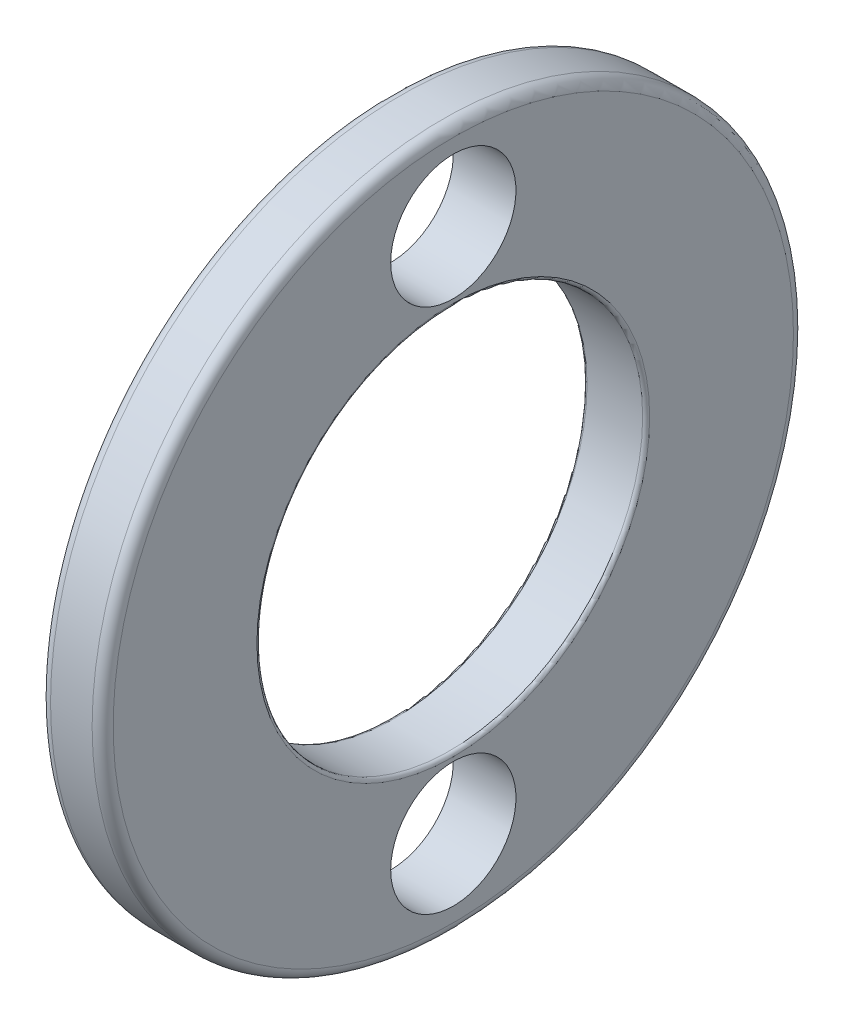
from build123d import *

# Parameters (mm, degrees)
CROQUIS2_R     = 3.572
EXTRUIR1_DEPTH = 12.358
CROQUIS3_R     = 3.572
EXTRUIR2_DEPTH = 12.358


with BuildPart() as part:
    # Croquis1 → Revolución1 (revolve)
    with BuildSketch(Plane.XY, mode=Mode.PRIVATE) as revoluci_n1_sk:
        with BuildLine():
            Line((5.214, 19.4), (5.214, 11.2))
            ThreePointArc((5.214, 11.2), (5.272578644, 11.058578644), (5.414, 11))
            Line((5.414, 11), (8.586, 11))
            ThreePointArc((8.586, 11), (8.727421356, 11.058578644), (8.786, 11.2))
            Line((8.786, 11.2), (8.786, 19.4))
            ThreePointArc((8.786, 19.4), (8.610264069, 19.824264069), (8.186, 20))
            Line((8.186, 20), (5.814, 20))
            ThreePointArc((5.814, 20), (5.389735931, 19.824264069), (5.214, 19.4))
        make_face()
    revolve(revoluci_n1_sk.sketch.rotate(Axis((50, 0, 0), (-1, 0, 0)), 90), axis=Axis((50, 0, 0), (-1, 0, 0)))

    # Croquis2 → Extruir1 (cut)
    with BuildSketch(Plane(origin=(0, 0, 0), x_dir=(0, 0, -1), z_dir=(1, 0, 0))):
        with Locations(Location((0, 15, 0), (0, 0, 180))):
            Circle(CROQUIS2_R)
    extrude(amount=EXTRUIR1_DEPTH, mode=Mode.SUBTRACT)

    # Croquis3 → Extruir2 (cut)
    with BuildSketch(Plane(origin=(0, 0, 0), x_dir=(0, 0, -1), z_dir=(1, 0, 0))):
        with Locations(Location((0, -15, 0), (0, 0, 180))):
            Circle(CROQUIS3_R)
    extrude(amount=EXTRUIR2_DEPTH, mode=Mode.SUBTRACT)


solid = part.part
